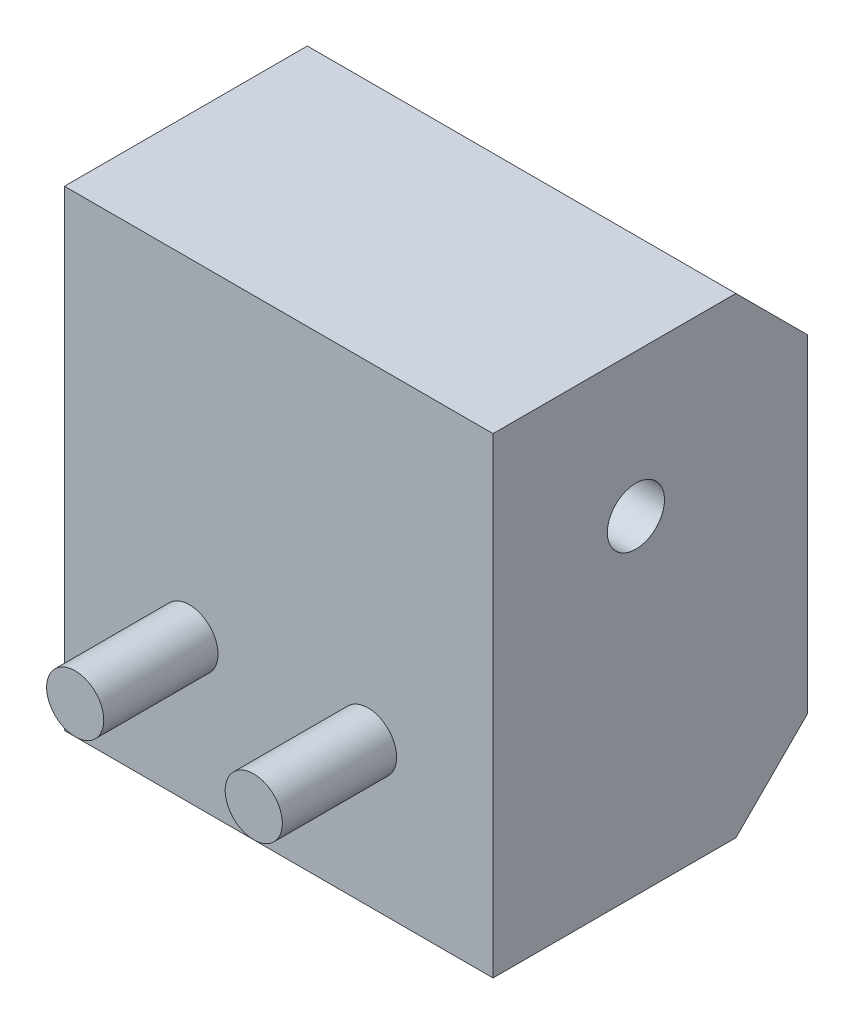
from build123d import *

# Parameters (mm, degrees)
CROQUIS1_W              = 30
CROQUIS1_H              = 33
SALIENTE_EXTRUIR1_DEPTH = 22
CROQUIS2_R              = 2
SALIENTE_EXTRUIR2_DEPTH = 8
CHAFL_N1_SIZE           = 5
CHAFL_N2_SIZE           = 5
CROQUIS3_R              = 2
CORTAR_EXTRUIR1_DEPTH   = 35


with BuildPart() as part:
    # Croquis1 → Saliente-Extruir1 (new body)
    with BuildSketch(Plane.XY):
        with Locations((-0.166051661, -4.433579336)):
            Rectangle(CROQUIS1_W, CROQUIS1_H)
    extrude(amount=SALIENTE_EXTRUIR1_DEPTH)

    # Croquis2 → Saliente-Extruir2 (add)
    with BuildSketch(Plane.XY.offset(22)):
        with Locations((-6.416051661, -10.933579336)):
            Circle(CROQUIS2_R)
        with Locations((6.083948339, -10.933579336)):
            Circle(CROQUIS2_R)
    extrude(amount=SALIENTE_EXTRUIR2_DEPTH)

    # Chaflán1
    chafl_n1_edges = [part.edges().sort_by_distance(p)[0] for p in [
        (-0.166051661, 12.066420664, 0),
    ]]
    chamfer(chafl_n1_edges, length=CHAFL_N1_SIZE)

    # Chaflán2
    chafl_n2_edges = [part.edges().sort_by_distance(p)[0] for p in [
        (-0.166051661, -20.933579336, 0),
    ]]
    chamfer(chafl_n2_edges, length=CHAFL_N2_SIZE)

    # Croquis3 → Cortar-Extruir1 (cut)
    with BuildSketch(Plane(origin=(14.833948339, 0, 0), x_dir=(0, 0, -1), z_dir=(1, 0, 0))):
        with Locations(Location((-12, 2.066420664, 0), (0, 0, 90))):
            Circle(CROQUIS3_R)
    extrude(amount=-CORTAR_EXTRUIR1_DEPTH, mode=Mode.SUBTRACT)


solid = part.part
